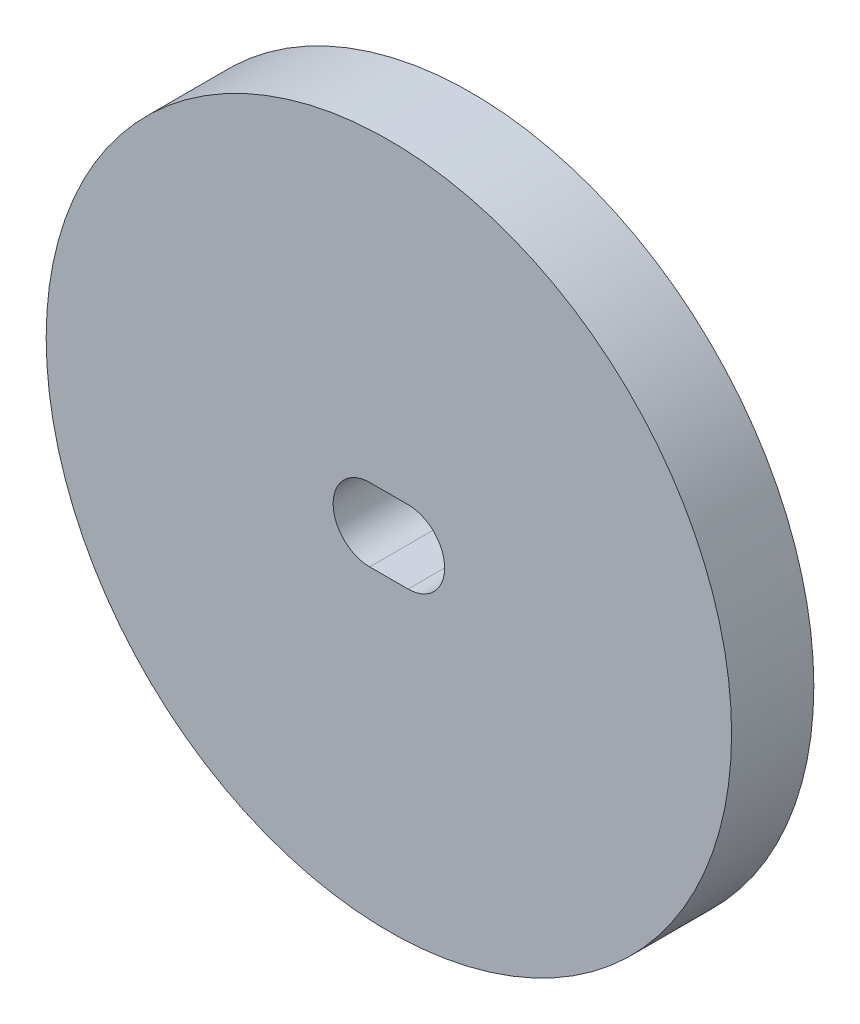
from build123d import *

# Parameters (mm, degrees)
SKETCH1_R           = 18.75
BOSS_EXTRUDE1_DEPTH = 4.5


with BuildPart() as part:
    # Sketch1 → Boss-Extrude1 (new body)
    with BuildSketch(Plane.XY):
        Circle(SKETCH1_R)
        with BuildLine():
            Line((-1.05, 2), (1.05, 2))
            ThreePointArc((1.05, 2), (3.05, 0), (1.05, -2))
            Line((1.05, -2), (-1.05, -2))
            ThreePointArc((-1.05, -2), (-3.05, 0), (-1.05, 2))
        make_face(mode=Mode.SUBTRACT)
    extrude(amount=BOSS_EXTRUDE1_DEPTH)


solid = part.part
